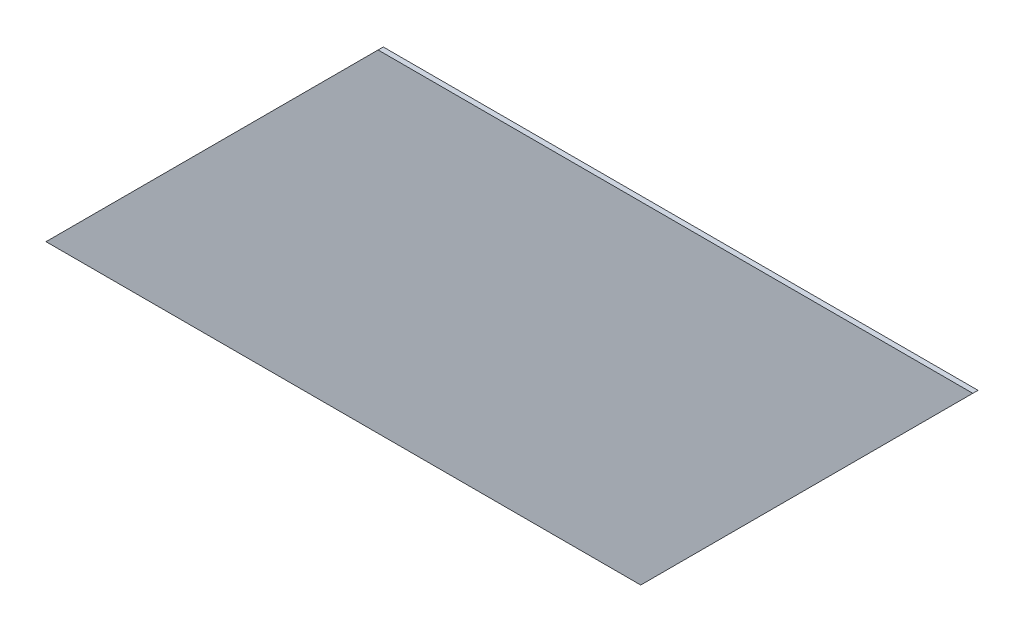
from build123d import *

# Parameters (mm, degrees)
BOSS_EXTRUDE1_DEPTH = 3.175


with BuildPart() as part:
    # Sketch1 → Boss-Extrude1 (new body)
    with BuildSketch(Plane.XY):
        Polygon((181.9529, -101.6), (385.1529, 101.6), (181.9529, 101.6), (21.2471, 101.6), (-181.9529, -101.6), align=None)
    extrude(amount=BOSS_EXTRUDE1_DEPTH)


solid = part.part
